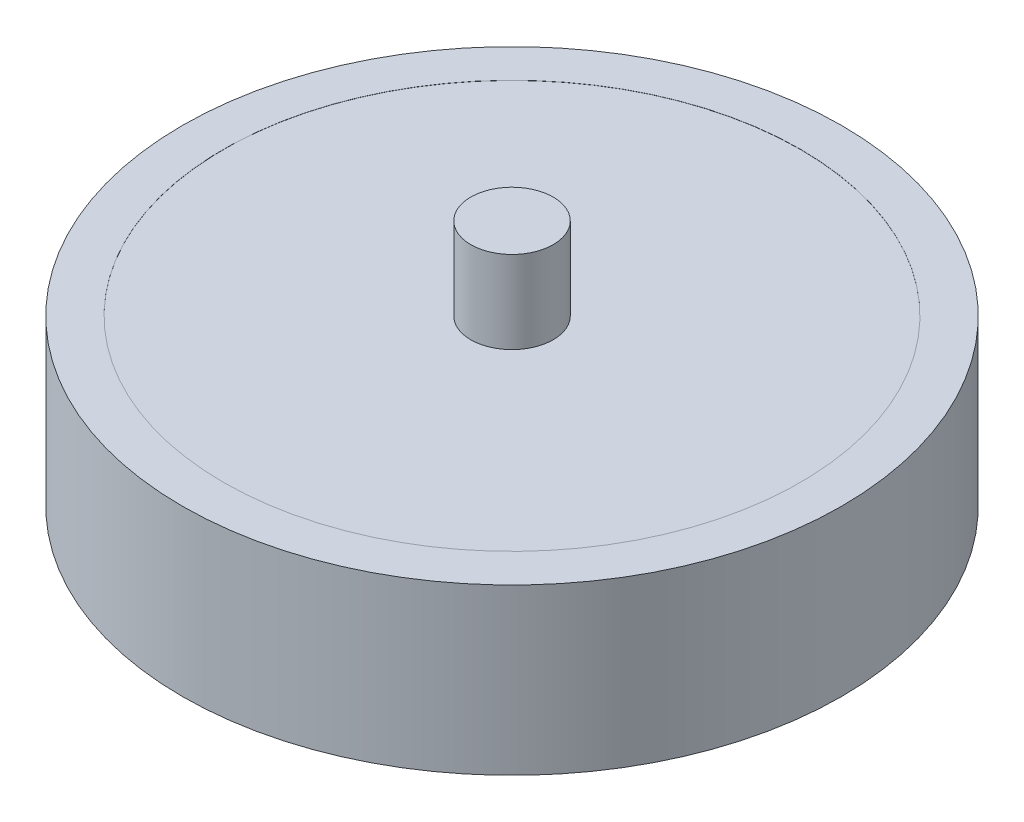
from build123d import *

# Parameters (mm, degrees)
SKETCH1_R           = 20
SKETCH1_R_2         = 17.5
BOSS_EXTRUDE1_DEPTH = 10
SKETCH2_R           = 17.5
BOSS_EXTRUDE3_DEPTH = 9.99
SKETCH4_R           = 2.5
BOSS_EXTRUDE4_DEPTH = 5
SKETCH3_R           = 2.5
CUT_EXTRUDE2_DEPTH  = 5


with BuildPart() as part:
    # Sketch1 → Boss-Extrude1 (new body)
    with BuildSketch(Plane(origin=(0, 0, 0), x_dir=(1, 0, 0), z_dir=(0, 1, 0))):
        with Locations(Location((0, 0, 0), (0, 0, 270))):
            Circle(SKETCH1_R)
        with Locations(Location((0, 0, 0), (0, 0, 270))):
            Circle(SKETCH1_R_2, mode=Mode.SUBTRACT)
    extrude(amount=BOSS_EXTRUDE1_DEPTH)



with BuildPart() as body_2:
    # Sketch2 → Boss-Extrude3 (new body)
    with BuildSketch(Plane(origin=(0, 0, 0), x_dir=(1, 0, 0), z_dir=(0, 1, 0))):
        with Locations(Location((0, 0, 0), (0, 0, 270))):
            Circle(SKETCH2_R)
    extrude(amount=BOSS_EXTRUDE3_DEPTH)


with BuildPart() as part_1:
    add(part.part)

    add(body_2.part)  # Boss-Extrude4 merges body 2
    # Sketch4 → Boss-Extrude4 (add)
    with BuildSketch(Plane(origin=(0, 9.99, 0), x_dir=(1, 0, 0), z_dir=(0, 1, 0))):
        with Locations(Location((0, 0, 0), (0, 0, 270))):
            Circle(SKETCH4_R)
    extrude(amount=BOSS_EXTRUDE4_DEPTH)

    # Sketch3 → Cut-Extrude2 (cut)
    with BuildSketch(Plane.XZ):
        with Locations(Location((0, 0, 0), (0, 0, 90))):
            Circle(SKETCH3_R)
    extrude(amount=-CUT_EXTRUDE2_DEPTH, mode=Mode.SUBTRACT)


solid = part_1.part
